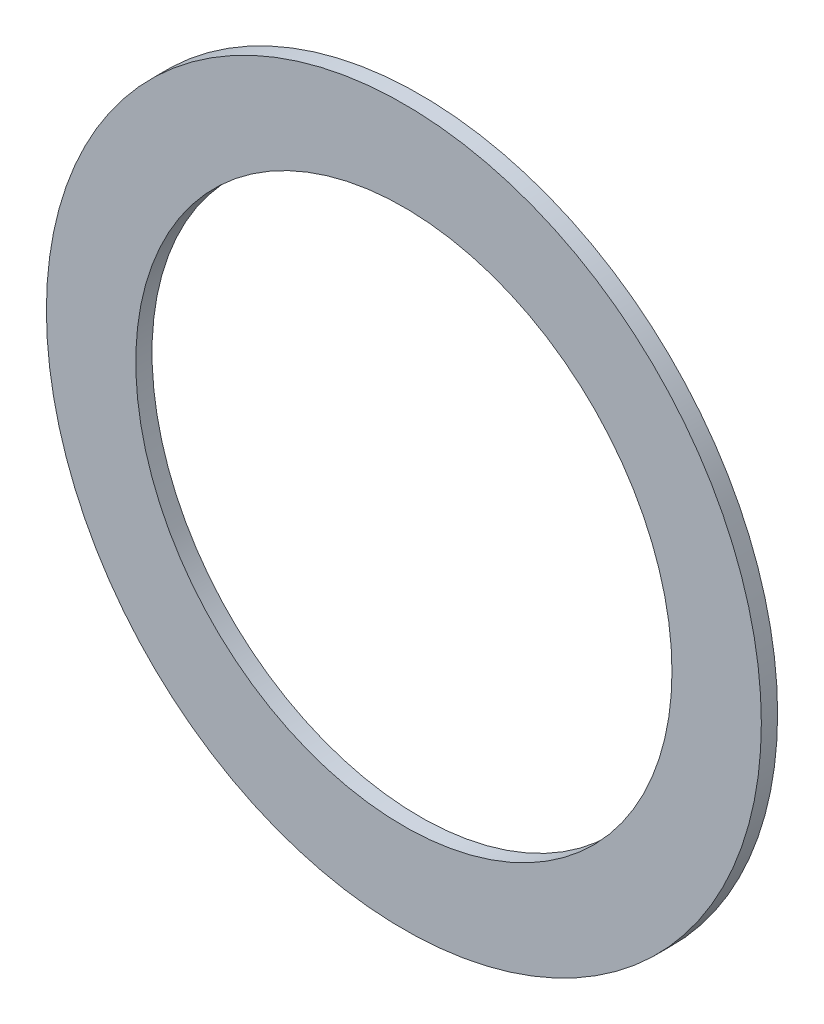
from build123d import *

# Parameters (mm, degrees)
BOSS_EXTRUDE1_DEPTH      = 0.5
BOSS_EXTRUDE1_DEPTH_BACK = 0.0001
SKETCH1_R                = 11
SKETCH1_R_2              = 8.25


with BuildPart() as part:
    # Sketch1 → Boss-Extrude1 (new, two sides: drawn at the far end of the back side and taken through both)
    with BuildSketch(Plane.XY.offset(-BOSS_EXTRUDE1_DEPTH_BACK)):
        Circle(SKETCH1_R)
        Circle(SKETCH1_R_2, mode=Mode.SUBTRACT)
    extrude(amount=BOSS_EXTRUDE1_DEPTH + BOSS_EXTRUDE1_DEPTH_BACK)


solid = part.part
